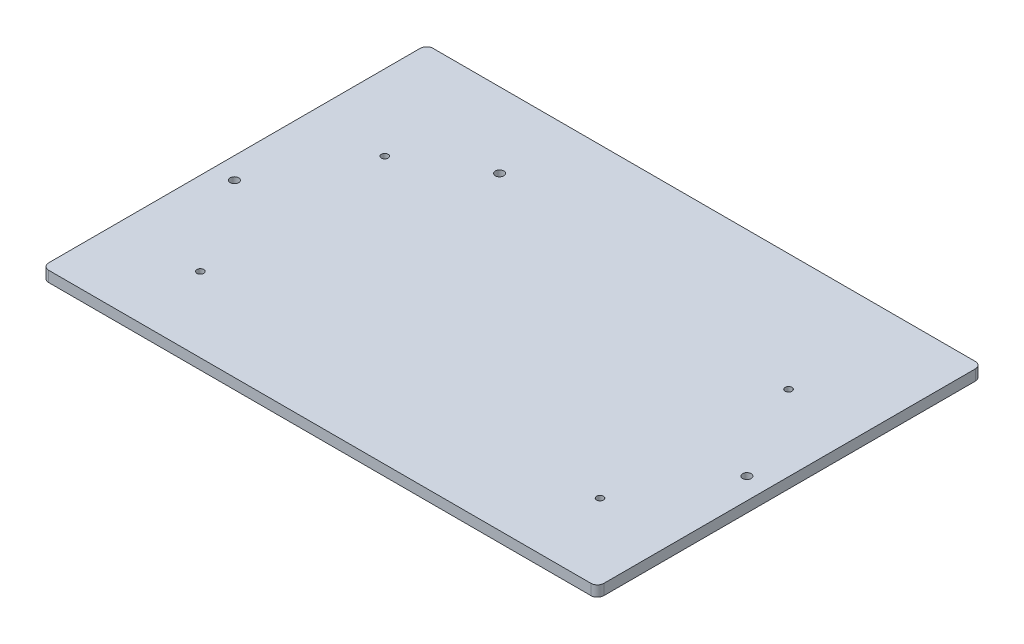
from build123d import *

# Parameters (mm, degrees)
SKETCH_1_W      = 260
SKETCH_1_H      = 180
SKETCH_1_R      = 1.6
SKETCH_1_R_2    = 2
EXTRUDE_1_DEPTH = 5
FILLET_1_R      = 3


with BuildPart() as part:
    # 草图1 → 凸台-拉伸1 (new body)
    with BuildSketch(Plane(origin=(0, 0, 0), x_dir=(1, 0, 0), z_dir=(0, 1, 0))):
        with Locations((5.029761905, -25.88277742)):
            Rectangle(SKETCH_1_W, SKETCH_1_H)
        with Locations(Location((-89.520238095, 9.07722258, 0), (0, 0, 270))):
            Circle(SKETCH_1_R, mode=Mode.SUBTRACT)
        with Locations(Location((99.579761905, 9.07722258, 0), (0, 0, 270))):
            Circle(SKETCH_1_R, mode=Mode.SUBTRACT)
        with Locations(Location((-85.930238095, -80.84277742, 0), (0, 0, 270))):
            Circle(SKETCH_1_R, mode=Mode.SUBTRACT)
        with Locations(Location((99.579761905, -79.200091518, 0), (0, 0, 270))):
            Circle(SKETCH_1_R, mode=Mode.SUBTRACT)
        with Locations(Location((-55.639680392, 28.987391576, 0), (0, 0, 270))):
            Circle(SKETCH_1_R_2, mode=Mode.SUBTRACT)
        with Locations(Location((-114.970238095, -35.88277742, 0), (0, 0, 270))):
            Circle(SKETCH_1_R_2, mode=Mode.SUBTRACT)
        with Locations(Location((125.029761905, -35.88277742, 0), (0, 0, 270))):
            Circle(SKETCH_1_R_2, mode=Mode.SUBTRACT)
    extrude(amount=EXTRUDE_1_DEPTH)

    # 圆角1
    fillet_1_edges = [part.edges().sort_by_distance(p)[0] for p in [
        (-124.970238095, 2.5, -64.11722258),
        (135.029761905, 2.5, -64.11722258),
        (135.029761905, 2.5, 115.88277742),
        (-124.970238095, 2.5, 115.88277742),
    ]]
    fillet(fillet_1_edges, radius=FILLET_1_R)


solid = part.part
